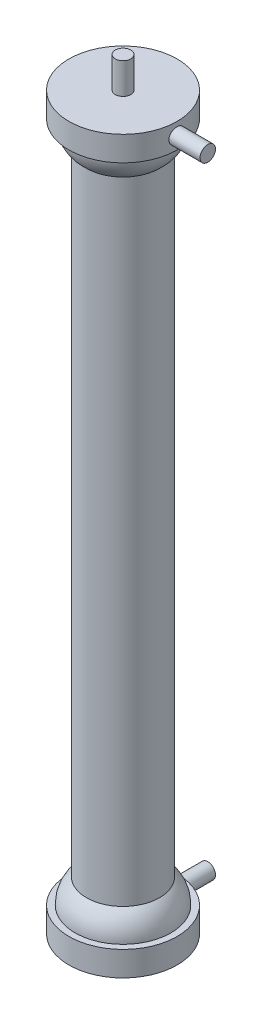
from build123d import *

# Parameters (mm, degrees)
SKETCH2_R           = 3.175
BOSS_EXTRUDE1_DEPTH = 34.798
SKETCH3_R           = 3.175
BOSS_EXTRUDE2_DEPTH = 34.798


with BuildPart() as part:
    # Sketch1 → Revolve1 (revolve)
    with BuildSketch(Plane.XY, mode=Mode.PRIVATE) as revolve1_sk:
        with BuildLine():
            Line((15, 33.02), (15, 292.38))
            ThreePointArc((15, 292.38), (18.521588729, 296.916296192), (19.685, 302.54))
            Line((19.685, 302.54), (22.225, 302.54))
            Line((22.225, 302.54), (22.225, 312.7))
            Line((22.225, 312.7), (3.175, 312.7))
            Line((3.175, 312.7), (3.175, 325.4))
            Line((3.175, 325.4), (0, 325.4))
            Line((0, 325.4), (0, 0))
            Line((0, 0), (3.175, 0))
            Line((3.175, 0), (3.175, 12.7))
            Line((3.175, 12.7), (22.225, 12.7))
            Line((22.225, 12.7), (22.225, 22.86))
            Line((22.225, 22.86), (19.685, 22.86))
            ThreePointArc((19.685, 22.86), (18.521588729, 28.483703808), (15, 33.02))
        make_face()
    revolve(revolve1_sk.sketch.rotate(Axis((0, -1025.4, 0), (0, 1, 0)), 90), axis=Axis((0, -1025.4, 0), (0, 1, 0)))

    # Sketch2 → Boss-Extrude1 (add)
    with BuildSketch(Plane(origin=(0, 0, 0), x_dir=(0, 0, -1), z_dir=(1, 0, 0))):
        with Locations(Location((0, 307.62, 0), (0, 0, 180))):
            Circle(SKETCH2_R)
    extrude(amount=BOSS_EXTRUDE1_DEPTH)

    # Sketch3 → Boss-Extrude2 (add)
    with BuildSketch(Plane.XY):
        with Locations((0, 17.78)):
            Circle(SKETCH3_R)
    extrude(amount=-BOSS_EXTRUDE2_DEPTH)


solid = part.part
